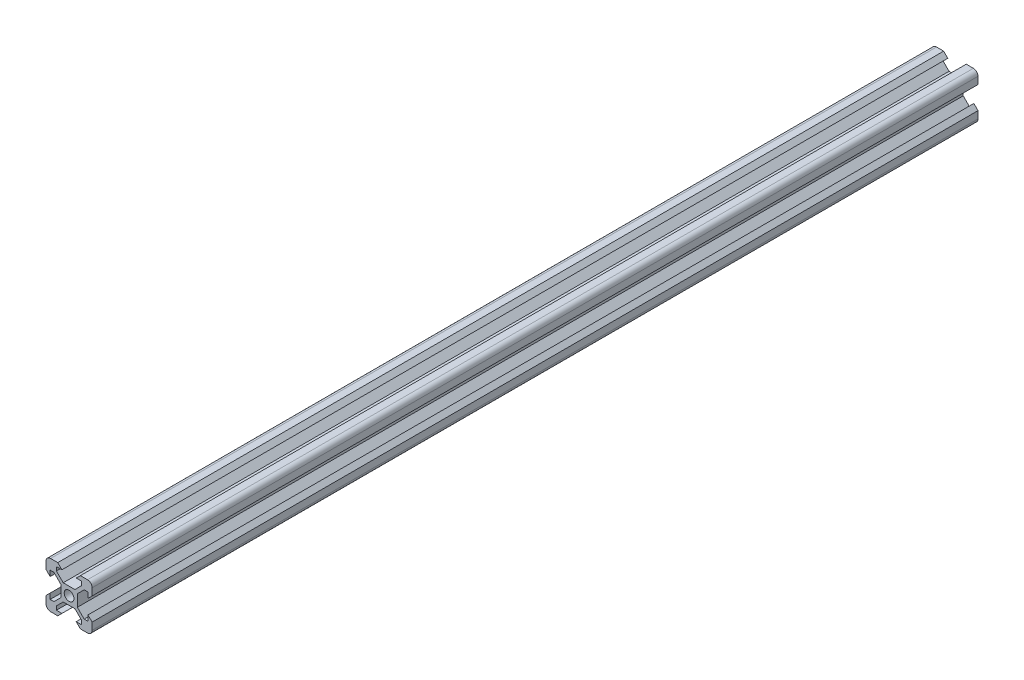
from build123d import *

# Parameters (mm, degrees)
SKETCH1_R           = 2.1
BOSS_EXTRUDE1_DEPTH = 384.175


with BuildPart() as part:
    # Sketch1 → Boss-Extrude1 (new body)
    with BuildSketch(Plane.XY):
        with BuildLine():
            Line((-4.9, -10), (-3.1, -8.2))
            Line((-3.1, -8.2), (-5.5, -8.2))
            Line((-5.5, -8.2), (-5.5, -6.560660172))
            Line((-5.5, -6.560660172), (-2.539339828, -3.6))
            Line((-2.539339828, -3.6), (2.539339828, -3.6))
            Line((2.539339828, -3.6), (5.5, -6.560660172))
            Line((5.5, -6.560660172), (5.5, -8.2))
            Line((5.5, -8.2), (3.1, -8.2))
            Line((3.1, -8.2), (4.9, -10))
            Line((4.9, -10), (8, -10))
            ThreePointArc((8, -10), (9.414213562, -9.414213562), (10, -8))
            Line((10, -8), (10, -4.9))
            Line((10, -4.9), (8.2, -3.1))
            Line((8.2, -3.1), (8.2, -5.5))
            Line((8.2, -5.5), (6.560660172, -5.5))
            Line((6.560660172, -5.5), (3.6, -2.539339828))
            Line((3.6, -2.539339828), (3.6, 2.539339828))
            Line((3.6, 2.539339828), (6.560660172, 5.5))
            Line((6.560660172, 5.5), (8.2, 5.5))
            Line((8.2, 5.5), (8.2, 3.1))
            Line((8.2, 3.1), (10, 4.9))
            Line((10, 4.9), (10, 8))
            ThreePointArc((10, 8), (9.414213562, 9.414213562), (8, 10))
            Line((8, 10), (4.9, 10))
            Line((4.9, 10), (3.1, 8.2))
            Line((3.1, 8.2), (5.5, 8.2))
            Line((5.5, 8.2), (5.5, 6.560660172))
            Line((5.5, 6.560660172), (2.539339828, 3.6))
            Line((2.539339828, 3.6), (-2.539339828, 3.6))
            Line((-2.539339828, 3.6), (-5.5, 6.560660172))
            Line((-5.5, 6.560660172), (-5.5, 8.2))
            Line((-5.5, 8.2), (-3.1, 8.2))
            Line((-3.1, 8.2), (-4.9, 10))
            Line((-4.9, 10), (-8, 10))
            ThreePointArc((-8, 10), (-9.414213562, 9.414213562), (-10, 8))
            Line((-10, 8), (-10, 4.9))
            Line((-10, 4.9), (-8.2, 3.1))
            Line((-8.2, 3.1), (-8.2, 5.5))
            Line((-8.2, 5.5), (-6.560660172, 5.5))
            Line((-6.560660172, 5.5), (-3.6, 2.539339828))
            Line((-3.6, 2.539339828), (-3.6, -2.539339828))
            Line((-3.6, -2.539339828), (-6.560660172, -5.5))
            Line((-6.560660172, -5.5), (-8.2, -5.5))
            Line((-8.2, -5.5), (-8.2, -3.1))
            Line((-8.2, -3.1), (-10, -4.9))
            Line((-10, -4.9), (-10, -8))
            ThreePointArc((-10, -8), (-9.414213562, -9.414213562), (-8, -10))
            Line((-8, -10), (-4.9, -10))
        make_face()
        Circle(SKETCH1_R, mode=Mode.SUBTRACT)
    extrude(amount=BOSS_EXTRUDE1_DEPTH)


solid = part.part
